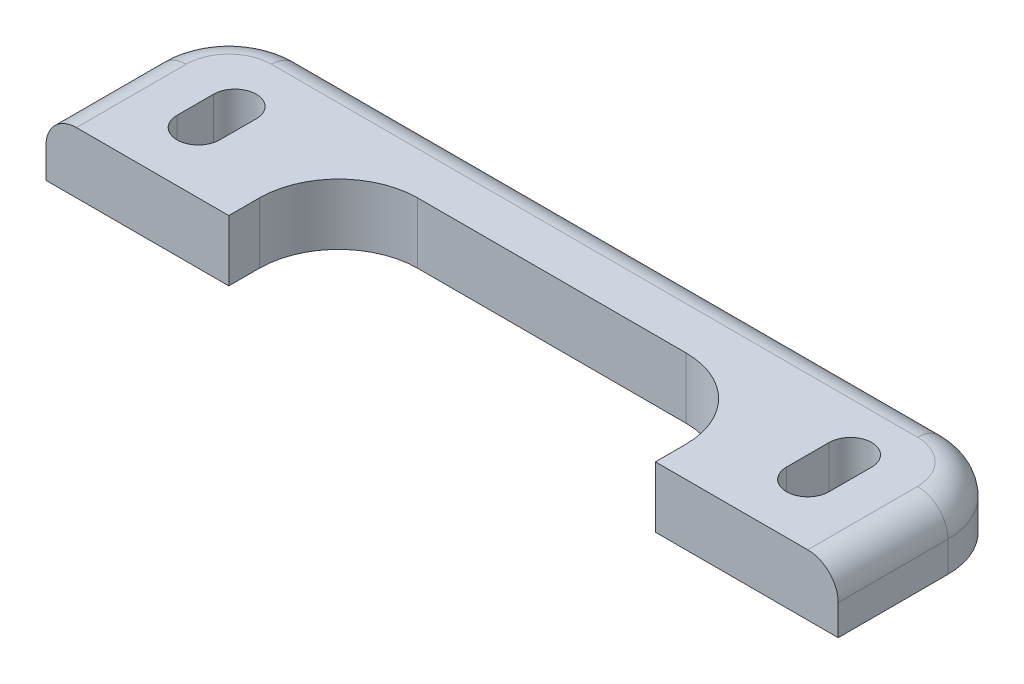
from build123d import *

# Parameters (mm, degrees)
BOSS_EXTRUDE1_DEPTH = 5
SKETCH4_R           = 1.75
CUT_EXTRUDE1_DEPTH  = 5
CUT_EXTRUDE2_DEPTH  = 5
SKETCH6_R           = 1.75
BOSS_EXTRUDE2_DEPTH = 5
SKETCH7_W           = 65
SKETCH7_H           = 7
CUT_EXTRUDE3_DEPTH  = 10
FILLET1_R           = 6
FILLET2_R           = 2.5


with BuildPart() as part:
    # Sketch3 → Boss-Extrude1 (new body)
    with BuildSketch(Plane(origin=(0, 0, 0), x_dir=(1, 0, 0), z_dir=(0, 1, 0))):
        Polygon((-32.5, 12), (-32.5, 22), (-22.5, 22), (22.5, 22), (32.5, 22), (32.5, 12), (32.5, 0), (-32.5, 0), align=None)
    extrude(amount=BOSS_EXTRUDE1_DEPTH)

    # Sketch4 → Cut-Extrude1 (cut)
    with BuildSketch(Plane(origin=(0, 5, 0), x_dir=(1, 0, 0), z_dir=(0, 1, 0))):
        with Locations(Location((-25, 5, 0), (0, 0, 270))):
            Circle(SKETCH4_R)
        with Locations(Location((0, 15.5, 0), (0, 0, 270))):
            Circle(SKETCH4_R)
        with Locations(Location((25, 5, 0), (0, 0, 270))):
            Circle(SKETCH4_R)
        with BuildLine():
            Line((-17.5, 0), (17.5, 0))
            Line((17.5, 0), (17.5, 2.5))
            ThreePointArc((17.5, 2.5), (15.596194078, 7.096194078), (11, 9))
            Line((11, 9), (-11, 9))
            ThreePointArc((-11, 9), (-15.596194078, 7.096194078), (-17.5, 2.5))
            Line((-17.5, 2.5), (-17.5, 0))
        make_face()
    extrude(amount=-CUT_EXTRUDE1_DEPTH, mode=Mode.SUBTRACT)

    # Sketch5 → Cut-Extrude2 (cut)
    with BuildSketch(Plane(origin=(0, 5, 0), x_dir=(1, 0, 0), z_dir=(0, 1, 0))):
        with BuildLine():
            Line((-26.75, 5), (-26.75, 8))
            ThreePointArc((-26.75, 8), (-25, 9.75), (-23.25, 8))
            Line((-23.25, 8), (-23.25, 5))
            Line((-23.25, 5), (-26.75, 5))
        make_face()
        with BuildLine():
            Line((23.25, 5), (26.75, 5))
            Line((26.75, 5), (26.75, 8.5))
            ThreePointArc((26.75, 8.5), (25, 10.25), (23.25, 8.5))
            Line((23.25, 8.5), (23.25, 5))
        make_face()
    extrude(amount=-CUT_EXTRUDE2_DEPTH, mode=Mode.SUBTRACT)

    # Sketch6 → Boss-Extrude2 (add)
    with BuildSketch(Plane(origin=(0, 5, 0), x_dir=(1, 0, 0), z_dir=(0, 1, 0))):
        with Locations((0, 15.5)):
            Circle(SKETCH6_R)
    extrude(amount=-BOSS_EXTRUDE2_DEPTH)

    # Sketch7 → Cut-Extrude3 (cut)
    with BuildSketch(Plane(origin=(0, 5, 0), x_dir=(1, 0, 0), z_dir=(0, 1, 0))):
        with Locations((0, 18.5)):
            Rectangle(SKETCH7_W, SKETCH7_H)
    extrude(amount=-CUT_EXTRUDE3_DEPTH, mode=Mode.SUBTRACT)

    # Fillet1
    fillet1_edges = [part.edges().sort_by_distance(p)[0] for p in [
        (-32.5, 2.5, -15),
        (32.5, 2.5, -15),
    ]]
    fillet(fillet1_edges, radius=FILLET1_R)

    # Fillet2
    fillet2_edges = [part.edges().sort_by_distance(p)[0] for p in [
        (0, 5, -15),
        (-32.5, 5, -4.5),
        (-30.742640687, 5, -13.242640687),
        (30.742640687, 5, -13.242640687),
        (32.5, 5, -4.5),
    ]]
    fillet(fillet2_edges, radius=FILLET2_R)


solid = part.part
